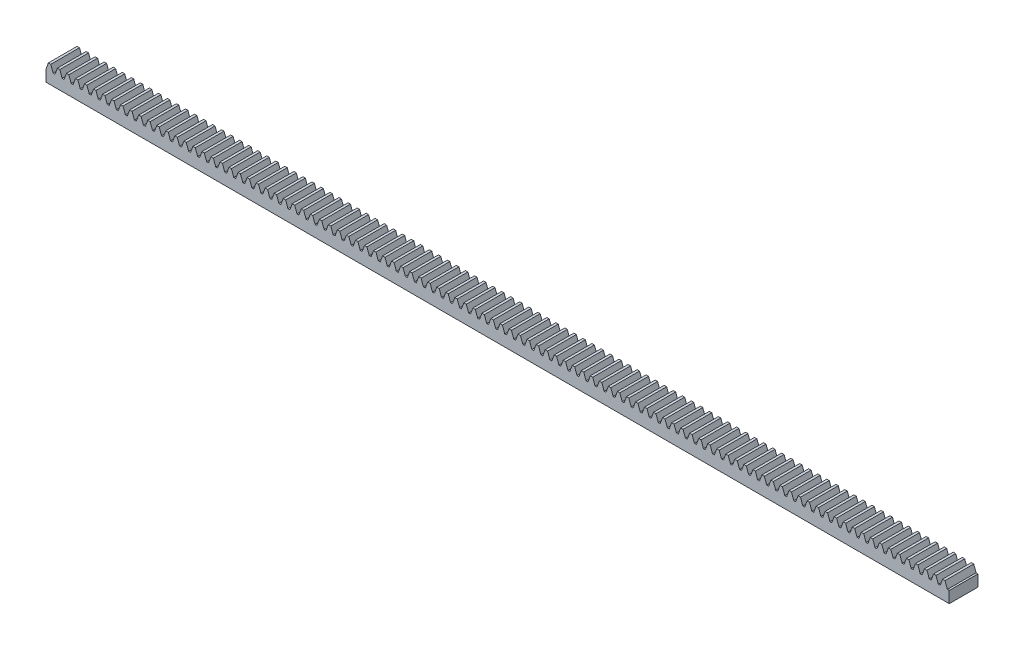
from build123d import *

# Parameters (mm, degrees)
SKETCH_1_W             = 628.318530718
SKETCH_1_H             = 7.95
EXTRUDE_1_DEPTH        = 20
EXTRUDE_2_DEPTH        = 20
PATTERN_LINEAR_1_COUNT = 100
PATTERN_LINEAR_1_PITCH = 6.283185307


with BuildPart() as part:
    # 草图1 → 拉伸1 (new body)
    with BuildSketch(Plane.XY):
        with Locations((314.159265359, -3.975)):
            Rectangle(SKETCH_1_W, SKETCH_1_H)
    extrude(amount=EXTRUDE_1_DEPTH)

    # 草图2 → 拉伸2 (add)
    with BuildSketch(Plane.XY.offset(20)):
        Polygon((0, 0), (1.637866054, 4.5), (3.323577771, 4.5), (4.961443825, 0), align=None)
    extrude_2 = extrude(amount=-EXTRUDE_2_DEPTH)

    # 阵列(线性)1: 拉伸2 ×100
    with Locations(*[(i * PATTERN_LINEAR_1_PITCH, 0, 0) for i in range(1, PATTERN_LINEAR_1_COUNT)]):
        add(extrude_2)


solid = part.part
